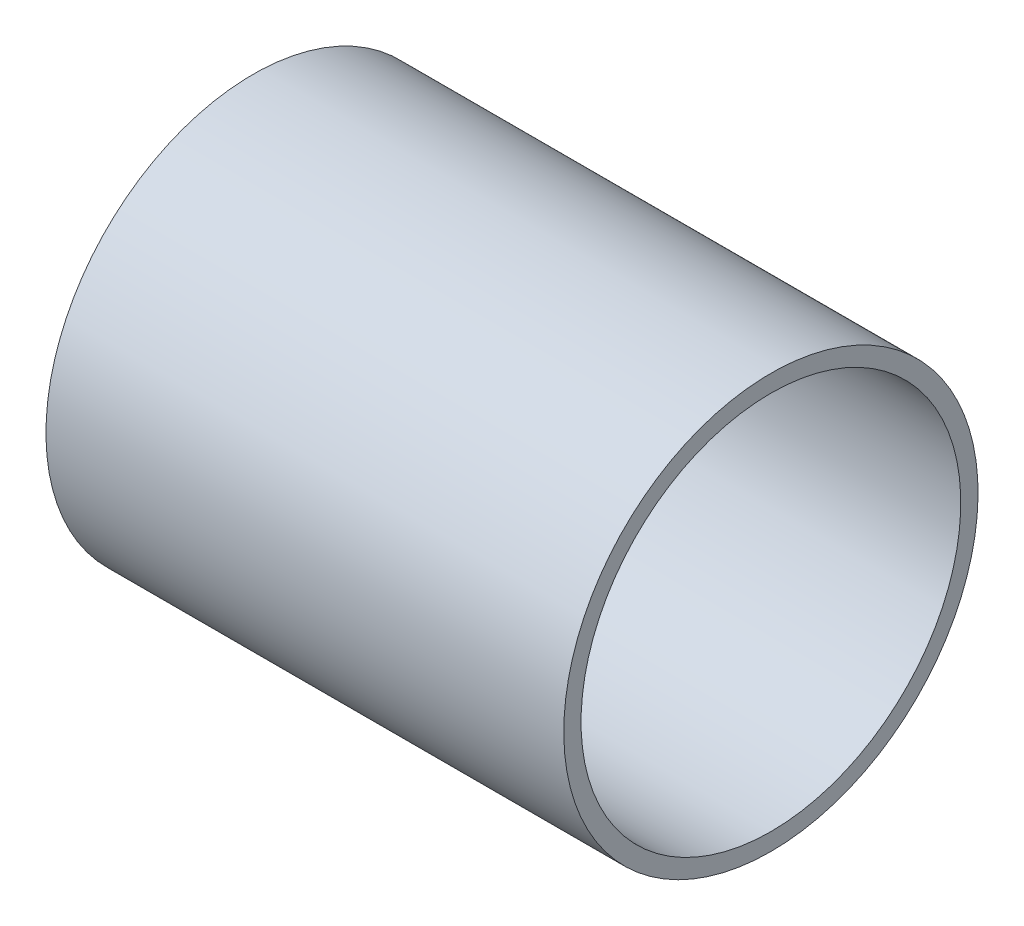
from build123d import *

# Parameters (mm, degrees)
SKETCH1_W = 30
SKETCH1_H = 1


with BuildPart() as part:
    # Sketch1 → Revolve1 (revolve)
    with BuildSketch(Plane.XY, mode=Mode.PRIVATE) as revolve1_sk:
        with Locations((0, 11.5)):
            Rectangle(SKETCH1_W, SKETCH1_H)
    revolve(revolve1_sk.sketch.rotate(Axis((-66.577474403, 0, 0), (1, 0, 0)), 180), axis=Axis((-66.577474403, 0, 0), (1, 0, 0)))


solid = part.part
